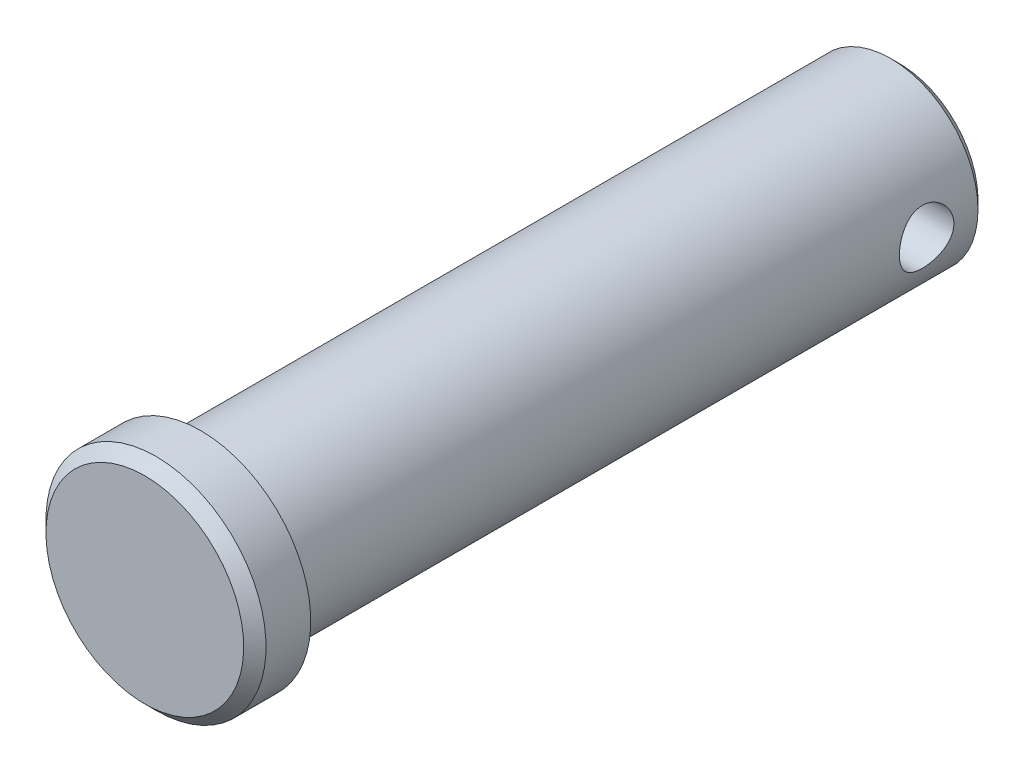
from build123d import *

# Parameters (mm, degrees)
CUT_EXTRUDE1_DEPTH      = 59.259372654
CUT_EXTRUDE1_DEPTH_BACK = 59.259372654
SKETCH2_R               = 1.9812
CHAMFER1_SIZE           = 0.8128
CHAMFER2_SIZE           = 0.635


with BuildPart() as part:
    # Sketch4 → Revolve1 (revolve)
    with BuildSketch(Plane(origin=(0, 0, 0), x_dir=(0, 0, -1), z_dir=(1, 0, 0)), mode=Mode.PRIVATE) as revolve1_sk:
        Polygon((-4.064, 0), (50.8, 0), (50.8, 6.35), (0, 6.35), (0, 8.001), (-4.064, 8.001), align=None)
    revolve(revolve1_sk.sketch.rotate(Axis((0, 0, 4.064), (0, 0, -1)), 180), axis=Axis((0, 0, 4.064), (0, 0, -1)))

    # Sketch2 → Cut-Extrude1 (cut, two sides: drawn at the far end of the back side and taken through both)
    with BuildSketch(Plane(origin=(0, 0, 6.35), x_dir=(0, 0, 1), z_dir=(-1, 0, 0)).offset(-CUT_EXTRUDE1_DEPTH_BACK)):
        with Locations((-52.7812, 0)):
            Circle(SKETCH2_R)
    extrude(amount=CUT_EXTRUDE1_DEPTH + CUT_EXTRUDE1_DEPTH_BACK, mode=Mode.SUBTRACT)

    # Chamfer1
    chamfer1_edges = [part.edges().sort_by_distance(p)[0] for p in [
        (0, 8.001, 4.064),
    ]]
    chamfer(chamfer1_edges, length=CHAMFER1_SIZE)

    # Chamfer2
    chamfer2_edges = [part.edges().sort_by_distance(p)[0] for p in [
        (0, 6.35, -50.8),
    ]]
    chamfer(chamfer2_edges, length=CHAMFER2_SIZE)


solid = part.part
